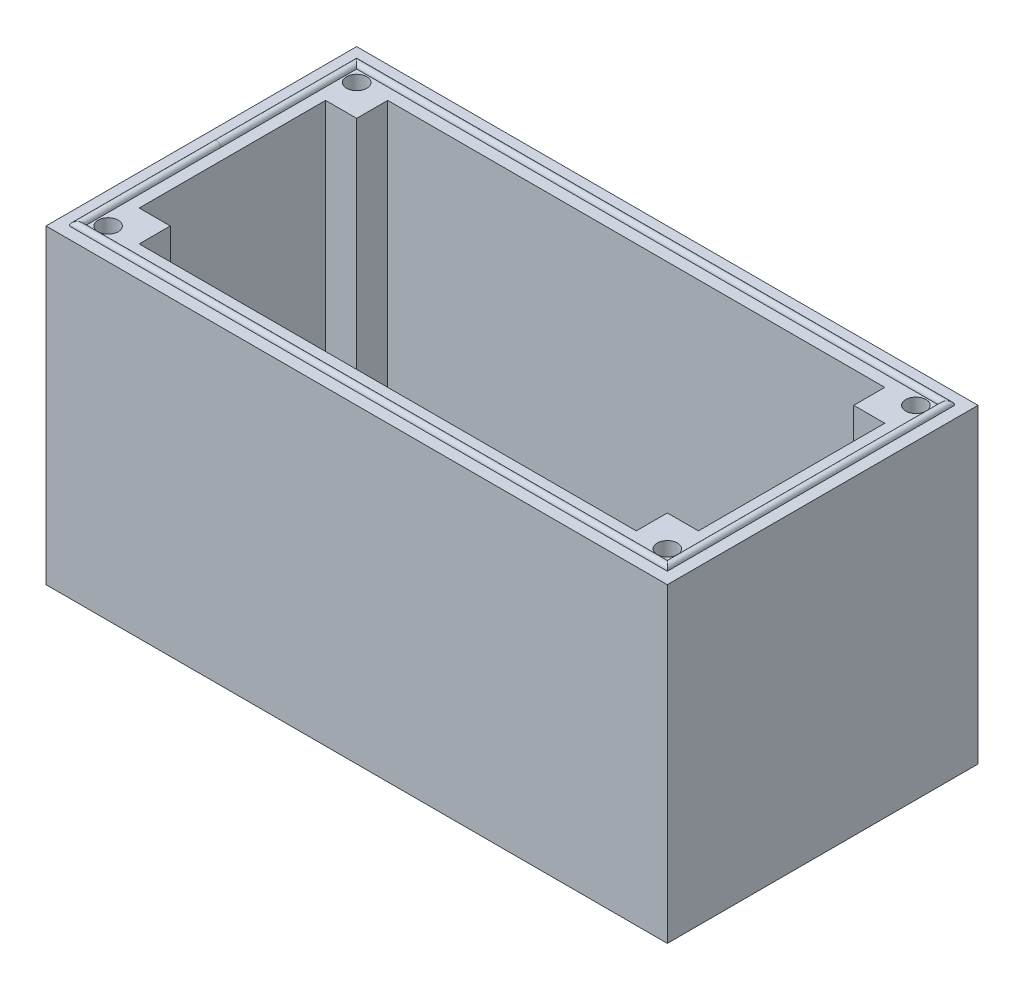
from build123d import *

# Parameters (mm, degrees)
SCHIZZO1_W                     = 40
SCHIZZO1_H                     = 20
ESTRUSIONE_ESTRUSIONE1_DEPTH   = 20
TAGLIO_ESTRUSIONE1_DEPTH       = 20
FORO_PER_VITE_M1_1_D           = 1.3
FORO_PER_VITE_M1_1_CSINK_D     = 1.35
FORO_PER_VITE_M1_1_CSINK_ANGLE = 90
SPECCHIA2_COPY_1_D             = 1.3
SPECCHIA2_COPY_1_CSINK_D       = 1.35
SPECCHIA2_COPY_1_CSINK_ANGLE   = 90


with BuildPart() as part:
    # Schizzo1 → Estrusione-Estrusione1 (new body)
    with BuildSketch(Plane.XY):
        with Locations((20, 10)):
            Rectangle(SCHIZZO1_W, SCHIZZO1_H)
    extrude(amount=-ESTRUSIONE_ESTRUSIONE1_DEPTH)

    # Schizzo2 → Taglio-Estrusione1 (cut)
    with BuildSketch(Plane(origin=(0, 20, 0), x_dir=(1, 0, 0), z_dir=(0, 1, 0))):
        Polygon((4, 18), (4, 16), (2, 16), (2, 4), (4, 4), (4, 2), (36, 2), (36, 4), (38, 4), (38, 16), (36, 16), (36, 18), align=None)
    extrude(amount=-TAGLIO_ESTRUSIONE1_DEPTH, mode=Mode.SUBTRACT)

    # Sweep1: sweep along a path in Schizzo4
    with BuildLine(Plane(origin=(0, 20, 0), x_dir=(1, 0, 0), z_dir=(0, 1, 0))) as sweep1_path:
        Line((1, 19), (39, 19))
        Line((39, 19), (39, 1))
        Line((39, 1), (1, 1))
        Line((1, 1), (1, 19))
    # Schizzo3 → Sweep1 (sweep)
    with BuildSketch(Plane.XY.offset(-10)):
        with BuildLine():
            Line((0.75, 20), (1.25, 20))
            ThreePointArc((1.25, 20), (1, 20.25), (0.75, 20))
        make_face()
    sweep(path=sweep1_path.line, transition=Transition.RIGHT)

    # Taglia-Sweep1: sweep along a path in Schizzo5
    with BuildLine(Plane.XZ) as taglia_sweep1_path:
        Line((1, -19), (39, -19))
        Line((39, -19), (39, -1))
        Line((39, -1), (1, -1))
        Line((1, -1), (1, -19))
    # Schizzo6 → Taglia-Sweep1 (sweep, cut)
    with BuildSketch(Plane.XY.offset(-10)):
        with BuildLine():
            Line((0.75, 0), (1.25, 0))
            ThreePointArc((1.25, 0), (1, 0.25), (0.75, 0))
        make_face()
    sweep(path=taglia_sweep1_path.line, transition=Transition.RIGHT, mode=Mode.SUBTRACT)

    # Foro per Vite M1-1 (through all)
    with Locations(Plane(origin=(0, 0, 0), x_dir=(-1, 0, 0), z_dir=(0, -1, 0))):
        with Locations((-38, 18)):
            foro_per_vite_m1_1 = CounterSinkHole(FORO_PER_VITE_M1_1_D / 2, FORO_PER_VITE_M1_1_CSINK_D / 2, counter_sink_angle=FORO_PER_VITE_M1_1_CSINK_ANGLE)

    # Specchia1: Foro per Vite M1-1 across plane
    add(foro_per_vite_m1_1.mirror(Plane.XY.offset(-10)), mode=Mode.SUBTRACT)

    # Specchia2: Foro per Vite M1-1 across plane
    add(foro_per_vite_m1_1.mirror(Plane(origin=(20, 0, 0), x_dir=(0, 0, 1), z_dir=(1, 0, 0))), mode=Mode.SUBTRACT)

    # Specchia2 copy 1 (through all)
    with Locations(Plane(origin=(40, 0, -20), x_dir=(1, 0, 0), z_dir=(0, -1, 0))):
        with Locations((-38, 18)):
            CounterSinkHole(SPECCHIA2_COPY_1_D / 2, SPECCHIA2_COPY_1_CSINK_D / 2, counter_sink_angle=SPECCHIA2_COPY_1_CSINK_ANGLE)


solid = part.part
